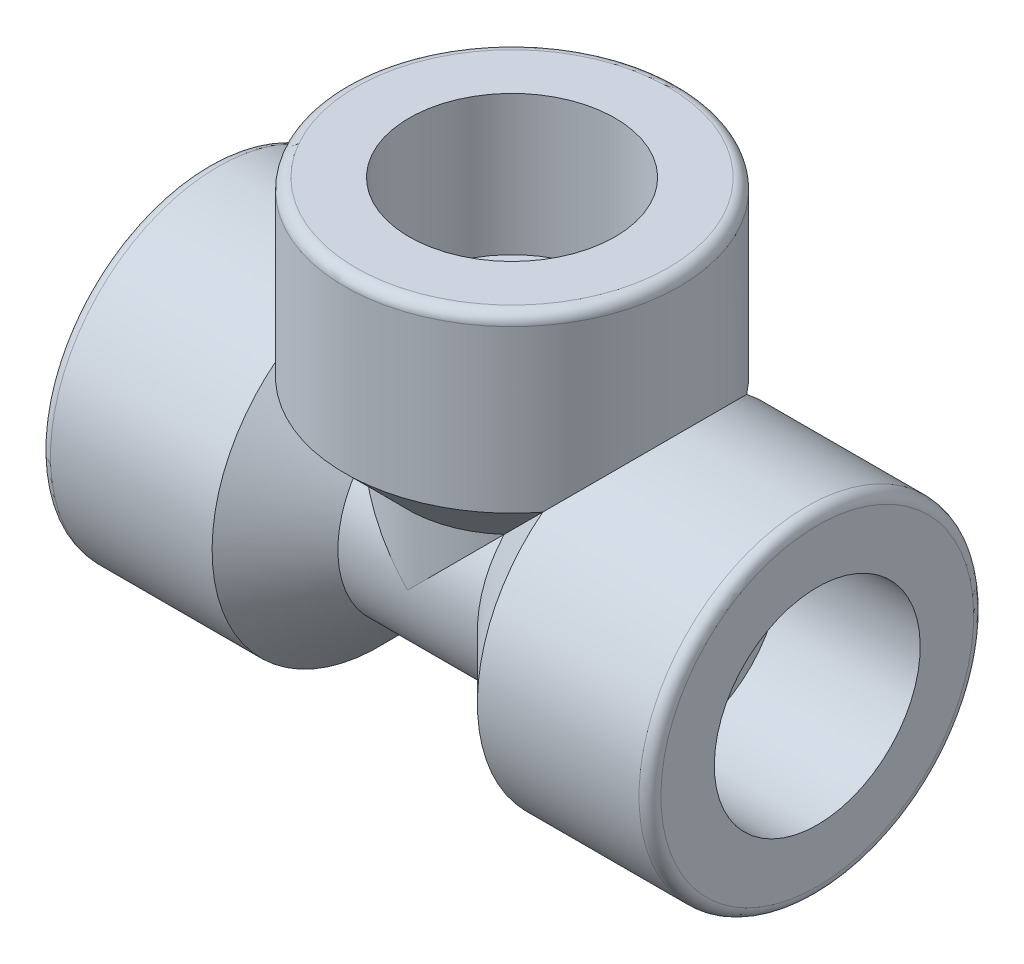
from build123d import *

# Parameters (mm, degrees)
CIRPATTERN2_COUNT       = 3
CIRPATTERN2_ANGLE       = 180
CUT_EXTRUDE1_DEPTH      = 32.976017529
CUT_EXTRUDE1_DEPTH_BACK = 32.976017529
SKETCH4_R               = 4.191
SKETCH5_R               = 4.191
CUT_EXTRUDE2_DEPTH      = 32.976017529


with BuildPart() as part:
    # Sketch2 → Revolve1 (revolve)
    with BuildSketch(Plane.XY, mode=Mode.PRIVATE) as revolve1_sk:
        with BuildLine():
            Line((-21.082, -7.112), (-11.43, -7.112))
            Line((-11.43, -7.112), (-11.43, -4.191))
            Line((-11.43, -4.191), (0, -4.191))
            Line((0, -4.191), (0, -7.2136))
            Line((0, -7.2136), (-4.81965, -7.2136))
            Line((-4.81965, -7.2136), (-9.16305, -11.557))
            Line((-9.16305, -11.557), (-20.32635, -11.557))
            ThreePointArc((-20.32635, -11.557), (-20.860675239, -11.335675239), (-21.082, -10.80135))
            Line((-21.082, -10.80135), (-21.082, -7.112))
        make_face()
    revolve(revolve1_sk.sketch.rotate(Axis((0, 0, 0), (-1, 0, 0)), 180), axis=Axis((0, 0, 0), (-1, 0, 0)))


with BuildPart() as cirpattern2_1:
    # CirPattern2: pattern copy
    add(part.part.rotate(Axis((0, 0, 0), (0, 0, -1)), 1 * CIRPATTERN2_ANGLE / (CIRPATTERN2_COUNT - 1)))

    # Sketch4 → Cut-Extrude1 (cut, two sides: drawn at the far end of the back side and taken through both)
    with BuildSketch(Plane(origin=(0, 0, 0), x_dir=(0, 0, -1), z_dir=(1, 0, 0)).offset(-CUT_EXTRUDE1_DEPTH_BACK)):
        with Locations(Location((0, 0, 0), (0, 0, 270))):
            Circle(SKETCH4_R)
    extrude(amount=CUT_EXTRUDE1_DEPTH + CUT_EXTRUDE1_DEPTH_BACK, mode=Mode.SUBTRACT)


with BuildPart() as cirpattern2_2:
    # CirPattern2: pattern copy
    add(part.part.rotate(Axis((0, 0, 0), (0, 0, -1)), 2 * CIRPATTERN2_ANGLE / (CIRPATTERN2_COUNT - 1)))


with BuildPart() as part_1:
    add(part.part)

    # Combine1: union CirPattern2_1, CirPattern2_2
    add(cirpattern2_1.part)
    add(cirpattern2_2.part)

    # Sketch5 → Cut-Extrude2 (cut, through all)
    with BuildSketch(Plane(origin=(0, 0, 0), x_dir=(1, 0, 0), z_dir=(0, 1, 0))):
        Circle(SKETCH5_R)
    extrude(amount=CUT_EXTRUDE2_DEPTH, mode=Mode.SUBTRACT)


solid = part_1.part
